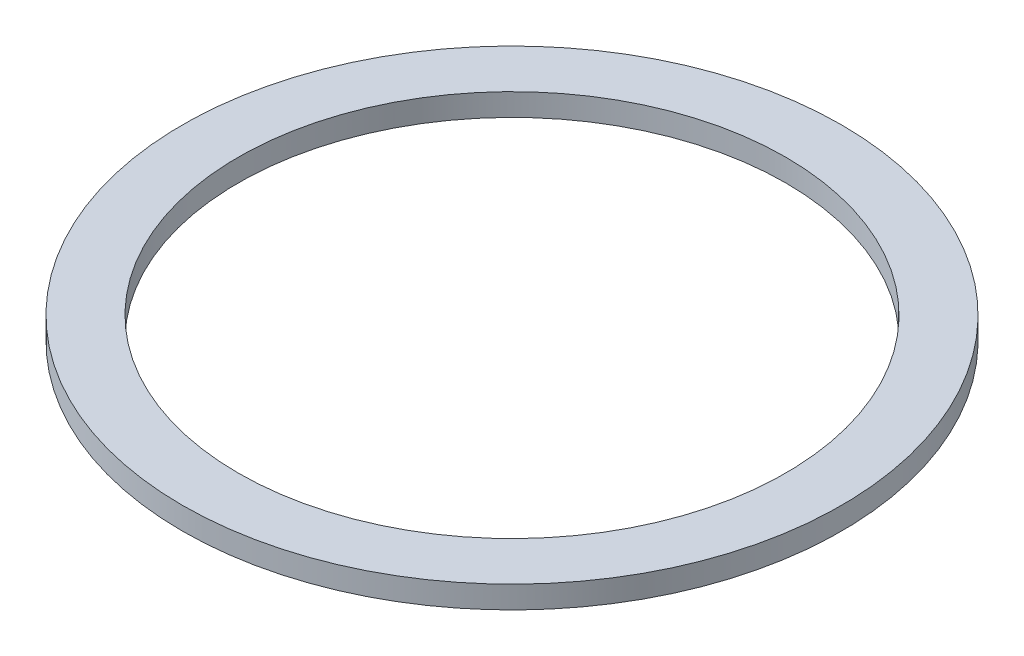
from build123d import *

# Parameters (mm, degrees)
SKETCH_1_R      = 29.5
SKETCH_1_R_2    = 24.5
EXTRUDE_1_DEPTH = 2


with BuildPart() as part:
    # Эскиз1 → Бобышка-Вытянуть1 (new body)
    with BuildSketch(Plane(origin=(0, 0, 0), x_dir=(1, 0, 0), z_dir=(0, 1, 0))):
        with Locations(Location((0, 0, 0), (0, 0, 270))):
            Circle(SKETCH_1_R)
        with Locations(Location((0, 0, 0), (0, 0, 270))):
            Circle(SKETCH_1_R_2, mode=Mode.SUBTRACT)
    extrude(amount=EXTRUDE_1_DEPTH)


solid = part.part
